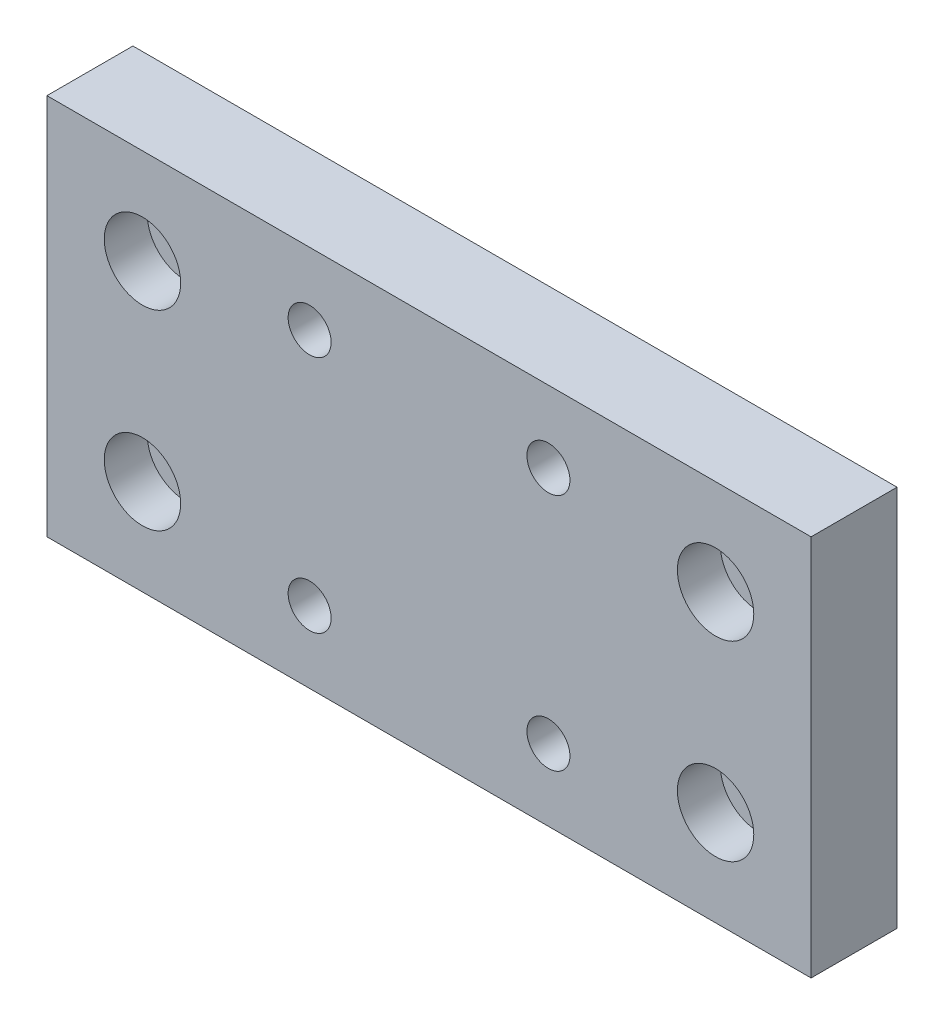
from build123d import *

# Parameters (mm, degrees)
SKETCH_1_W          = 80
SKETCH_1_H          = 40
EXTRUDE_1_DEPTH     = 9
SKETCH_2_R          = 2.25
CUT_EXTRUDE_1_DEPTH = 46.617978912
SKETCH_3_R          = 2.25
CUT_EXTRUDE_2_DEPTH = 9
SKETCH_4_R          = 4
CUT_EXTRUDE_3_DEPTH = 4.5
SKETCH_6_R          = 4
CUT_EXTRUDE_5_DEPTH = 4.5


with BuildPart() as part:
    # 草图1 → 凸台-拉伸1 (new body)
    with BuildSketch(Plane.XY):
        Rectangle(SKETCH_1_W, SKETCH_1_H)
    extrude(amount=EXTRUDE_1_DEPTH)

    # 草图2 → 切除-拉伸1 (cut, through all)
    with BuildSketch(Plane(origin=(0, 0, 0), x_dir=(-1, 0, 0), z_dir=(0, 0, -1))):
        with Locations((30, 10)):
            Circle(SKETCH_2_R)
        with Locations((30, -10)):
            Circle(SKETCH_2_R)
    cut_extrude_1 = extrude(amount=-CUT_EXTRUDE_1_DEPTH, mode=Mode.SUBTRACT)

    # 镜向1: 切除-拉伸1 across plane
    add(cut_extrude_1.mirror(Plane(origin=(0, 0, 0), x_dir=(0, 0, 1), z_dir=(1, 0, 0))), mode=Mode.SUBTRACT)

    # 草图3 → 切除-拉伸2 (cut)
    with BuildSketch(Plane(origin=(0, 0, 0), x_dir=(-1, 0, 0), z_dir=(0, 0, -1))):
        with Locations((12.5, -12.5)):
            Circle(SKETCH_3_R)
        with Locations((12.5, 12.5)):
            Circle(SKETCH_3_R)
    cut_extrude_2 = extrude(amount=-CUT_EXTRUDE_2_DEPTH, mode=Mode.SUBTRACT)

    # 镜向2: 切除-拉伸2 across plane
    add(cut_extrude_2.mirror(Plane(origin=(0, 0, 0), x_dir=(0, 0, 1), z_dir=(1, 0, 0))), mode=Mode.SUBTRACT)

    # 草图4 → 切除-拉伸3 (cut)
    with BuildSketch(Plane(origin=(0, 0, 0), x_dir=(-1, 0, 0), z_dir=(0, 0, -1))):
        with Locations((12.5, 12.5)):
            Circle(SKETCH_4_R)
        with Locations((12.5, -12.5)):
            Circle(SKETCH_4_R)
        with Locations((-12.5, 12.5)):
            Circle(SKETCH_4_R)
        with Locations((-12.5, -12.5)):
            Circle(SKETCH_4_R)
    extrude(amount=-CUT_EXTRUDE_3_DEPTH, mode=Mode.SUBTRACT)

    # 草图6 → 切除-拉伸5 (cut)
    with BuildSketch(Plane.XY.offset(9)):
        with Locations((-30, -10)):
            Circle(SKETCH_6_R)
        with Locations((-30, 10)):
            Circle(SKETCH_6_R)
        with Locations((30, -10)):
            Circle(SKETCH_6_R)
        with Locations((30, 10)):
            Circle(SKETCH_6_R)
    extrude(amount=-CUT_EXTRUDE_5_DEPTH, mode=Mode.SUBTRACT)


solid = part.part
